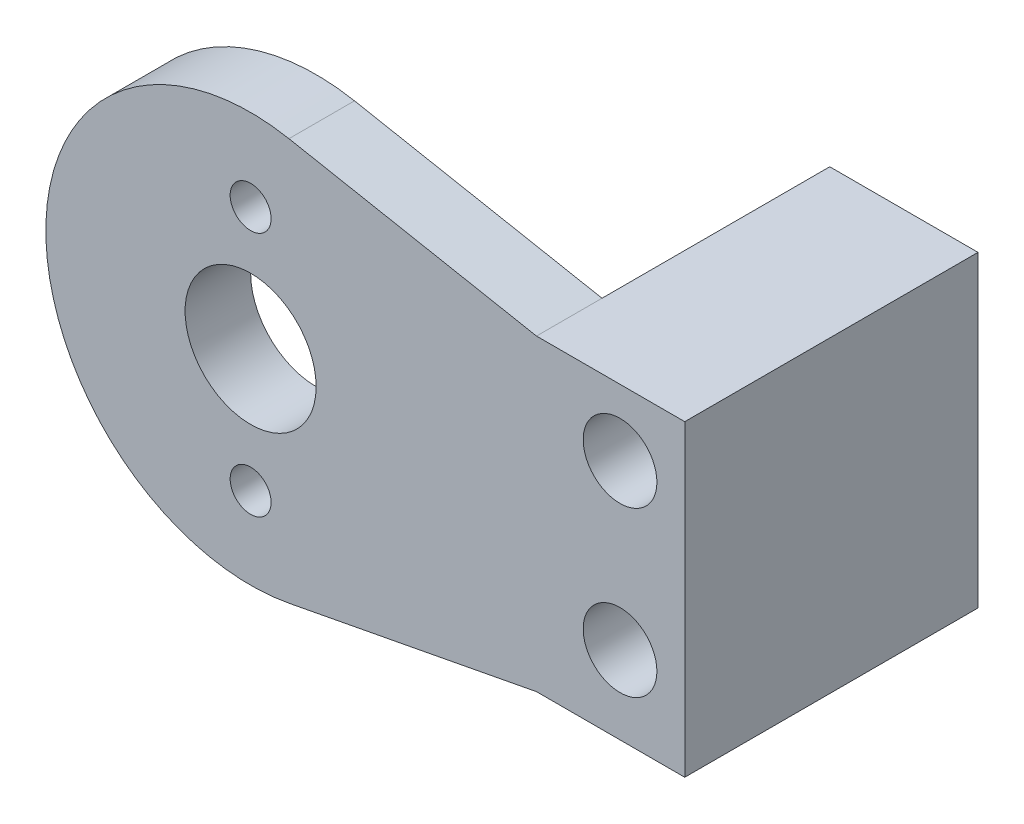
from build123d import *

# Parameters (mm, degrees)
BOSS_EXTRUDE1_DEPTH = 4.000000656
SKETCH2_W           = 9.05
SKETCH2_H           = 18.8
BOSS_EXTRUDE2_DEPTH = 13.9
SKETCH3_R           = 4
SKETCH3_R_2         = 2.25
SKETCH3_R_3         = 1.25
CUT_EXTRUDE1_DEPTH  = 30


with BuildPart() as part:
    # Sketch1 → Boss-Extrude1 (new body)
    with BuildSketch(Plane(origin=(0, 0, 79.940542579), x_dir=(-1, 0, 0), z_dir=(0, 0, -1))):
        with BuildLine():
            Line((9.05, 0), (24.160371291, -2.879093513))
            ThreePointArc((24.160371291, -2.879093513), (39, 9.4), (24.160371291, 21.679093513))
            Line((24.160371291, 21.679093513), (9.05, 18.8))
            Line((9.05, 18.8), (0, 18.8))
            Line((0, 18.8), (0, 0))
            Line((0, 0), (9.05, 0))
        make_face()
    extrude(amount=-BOSS_EXTRUDE1_DEPTH)

    # Sketch2 → Boss-Extrude2 (add)
    with BuildSketch(Plane(origin=(0, 0, 79.940542579), x_dir=(-1, 0, 0), z_dir=(0, 0, -1))):
        with Locations((4.525, 9.4)):
            Rectangle(SKETCH2_W, SKETCH2_H)
    extrude(amount=BOSS_EXTRUDE2_DEPTH)

    # Sketch3 → Cut-Extrude1 (cut)
    with BuildSketch(Plane.XY.offset(83.940543234)):
        with Locations((-26.5, 9.4)):
            Circle(SKETCH3_R)
        with Locations((-3.95, 14.75)):
            Circle(SKETCH3_R_2)
        with Locations((-3.95, 4.75)):
            Circle(SKETCH3_R_2)
        with Locations((-26.5, 16.9)):
            Circle(SKETCH3_R_3)
        with Locations((-26.5, 1.9)):
            Circle(SKETCH3_R_3)
    extrude(amount=-CUT_EXTRUDE1_DEPTH, mode=Mode.SUBTRACT)


solid = part.part
